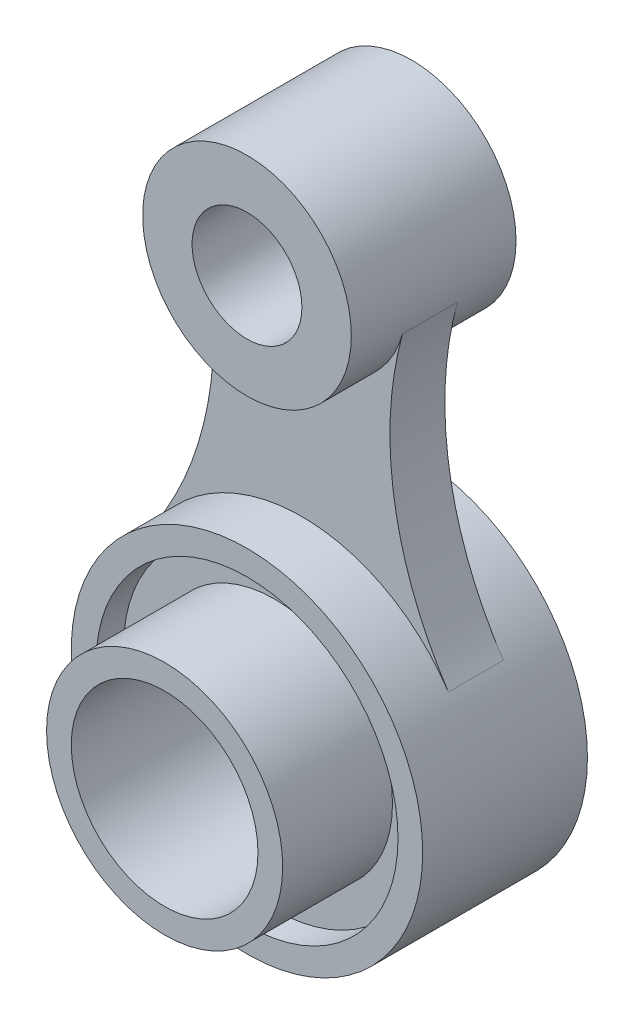
from build123d import *

# Parameters (mm, degrees)
ESQUISSE4_R             = 32
ESQUISSE4_R_2           = 17
BOSS_EXTRU_3_DEPTH      = 15
ESQUISSE4_R_3           = 19
ESQUISSE4_R_4           = 10
BOSS_EXTRU_3_2_DEPTH    = 15
ESQUISSE6_R             = 27.5
ESQUISSE6_R_2           = 21.5
ENL_V_MAT_EXTRU_2_DEPTH = 5
ESQUISSE11_R            = 21.5
ESQUISSE11_R_2          = 17
BOSS_EXTRU_4_DEPTH      = 15
BOSS_EXTRU_5_DEPTH      = 5


with BuildPart() as part:
    # Esquisse4 → Boss.-Extru.3 (new, symmetric)
    with BuildSketch(Plane.XY):
        Circle(ESQUISSE4_R)
        Circle(ESQUISSE4_R_2, mode=Mode.SUBTRACT)
    extrude(amount=BOSS_EXTRU_3_DEPTH, both=True)

    # Esquisse6 → Enlèv. mat.-Extru.2 (cut)
    with BuildSketch(Plane.XY.offset(15)):
        Circle(ESQUISSE6_R)
        Circle(ESQUISSE6_R_2, mode=Mode.SUBTRACT)
    extrude(amount=-ENL_V_MAT_EXTRU_2_DEPTH, mode=Mode.SUBTRACT)

    # Esquisse11 → Boss.-Extru.4 (add)
    with BuildSketch(Plane.XY.offset(15)):
        Circle(ESQUISSE11_R)
        Circle(ESQUISSE11_R_2, mode=Mode.SUBTRACT)
    extrude(amount=BOSS_EXTRU_4_DEPTH)



with BuildPart() as body_2:
    # Esquisse4 → Boss.-Extru.3 2 (new, symmetric)
    with BuildSketch(Plane.XY):
        with Locations((0, 75)):
            Circle(ESQUISSE4_R_3)
        with Locations((0, 75)):
            Circle(ESQUISSE4_R_4, mode=Mode.SUBTRACT)
    extrude(amount=BOSS_EXTRU_3_2_DEPTH, both=True)


with BuildPart() as part_1:
    add(part.part)

    add(body_2.part)  # Boss.-Extru.5 merges body 2
    # Esquisse13 → Boss.-Extru.5 (add, symmetric)
    with BuildSketch(Plane.XY):
        with BuildLine():
            ThreePointArc((-18.321243986, 69.966907631), (0, 56), (18.321243986, 69.966907631))
            ThreePointArc((18.321243986, 69.966907631), (16.836772686, 42.914041255), (26.678302647, 17.671111111))
            ThreePointArc((26.678302647, 17.671111111), (0, 32), (-26.678302647, 17.671111111))
            ThreePointArc((-26.678302647, 17.671111111), (-16.836772686, 42.914041255), (-18.321243986, 69.966907631))
        make_face()
    extrude(amount=BOSS_EXTRU_5_DEPTH, both=True)


solid = part_1.part
